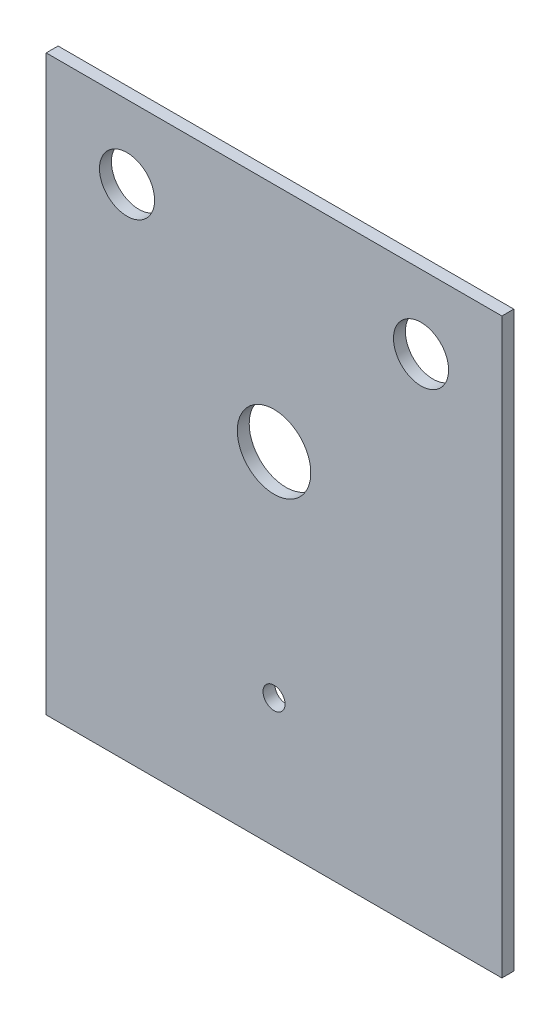
from build123d import *

# Parameters (mm, degrees)
SKETCH1_W           = 15.748
SKETCH1_H           = 19.812
SKETCH1_R           = 1.27
SKETCH1_R_2         = 0.952
SKETCH1_R_3         = 0.381
BOSS_EXTRUDE1_DEPTH = 0.41148


with BuildPart() as part:
    # Sketch1 → Boss-Extrude1 (new body)
    with BuildSketch(Plane(origin=(0, 0, 0), x_dir=(-1, 0, 0), z_dir=(0, 0, -1))):
        with Locations((-96.52, 73.914)):
            Rectangle(SKETCH1_W, SKETCH1_H)
        with Locations((-96.52, 75.819)):
            Circle(SKETCH1_R, mode=Mode.SUBTRACT)
        with Locations((-91.44, 81.28)):
            Circle(SKETCH1_R_2, mode=Mode.SUBTRACT)
        with Locations(Location((-96.52, 68.453, 0), (0, 0, 180))):
            Circle(SKETCH1_R_3, mode=Mode.SUBTRACT)
        with Locations((-101.6, 81.28)):
            Circle(SKETCH1_R_2, mode=Mode.SUBTRACT)
    extrude(amount=-BOSS_EXTRUDE1_DEPTH)


solid = part.part
